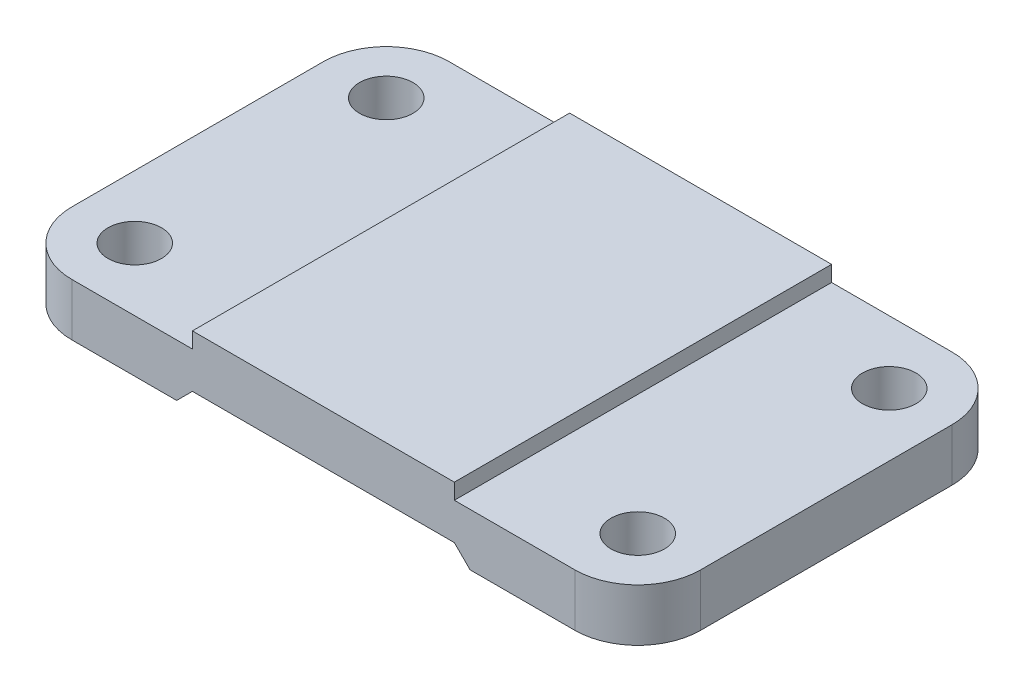
from build123d import *

# Parameters (mm, degrees)
SKETCH1_W              = 50
SKETCH1_H              = 3
BOSS_EXTRUDE2_DEPTH    = 72
M12_TAPPED_HOLE1_D     = 10.2
M12_TAPPED_HOLE1_DEPTH = 29.25
FILLET1_R              = 12


with BuildPart() as part:
    # Sketch1 → Boss-Extrude2 (new body)
    with BuildSketch(Plane.XY):
        Polygon((-25, 3.5), (25, 3.5), (60, 3.5), (60, -6.5), (28, -6.5), (25, -3.5), (-25, -3.5), (-28, -6.5), (-60, -6.5), (-60, 3.5), align=None)
        with Locations((0, 5)):
            Rectangle(SKETCH1_W, SKETCH1_H)
    extrude(amount=BOSS_EXTRUDE2_DEPTH)

    # M12 Tapped Hole1
    with Locations(Plane(origin=(0, 3.5, 0), x_dir=(1, 0, 0), z_dir=(0, 1, 0))):
        with Locations((-48, -12), (-48, -60), (48, -60), (48, -12)):
            Hole(M12_TAPPED_HOLE1_D / 2, depth=M12_TAPPED_HOLE1_DEPTH)

    # Fillet1
    fillet1_edges = [part.edges().sort_by_distance(p)[0] for p in [
        (-60, -1.5, 72),
        (60, -1.5, 0),
        (-60, -1.5, 0),
        (60, -1.5, 72),
    ]]
    fillet(fillet1_edges, radius=FILLET1_R)


solid = part.part
